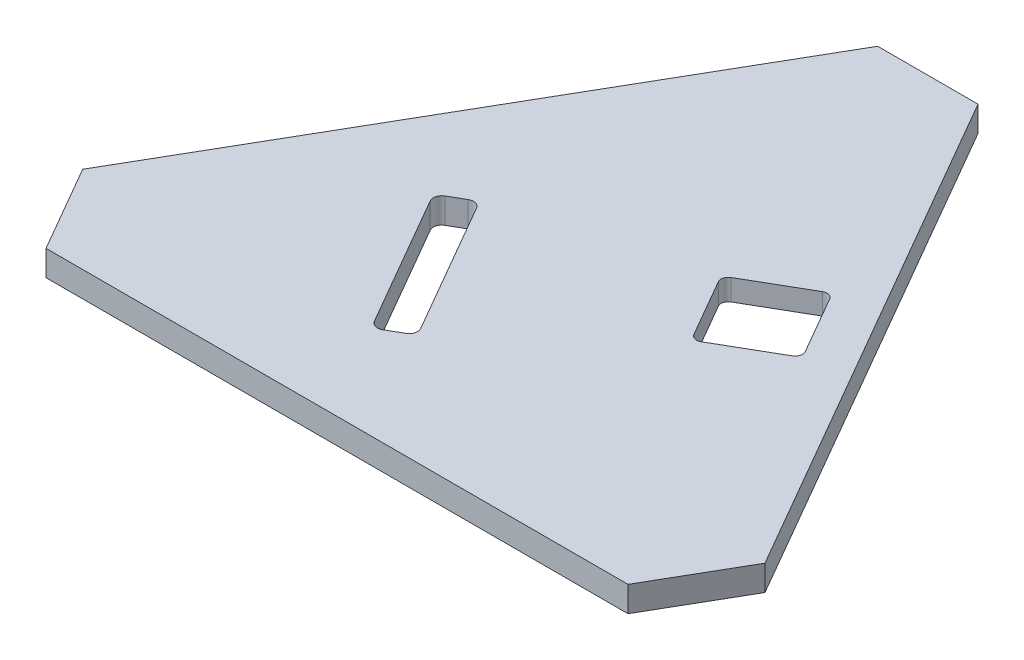
from build123d import *

# Parameters (mm, degrees)
BOSS_EXTRUDE1_DEPTH = 19.05
CUT_EXTRUDE1_DEPTH  = 20
CUT_EXTRUDE2_DEPTH  = 3.175
CUT_EXTRUDE3_DEPTH  = 19.05


with BuildPart() as part:
    # Sketch1 → Boss-Extrude1 (new body)
    with BuildSketch(Plane(origin=(-388.281715987, 0, -288.185661777), x_dir=(1, 0, 0), z_dir=(0, 1, 0))):
        Polygon((1747.570833697, -13084.824581071), (1672.514355591, -13084.824581071), (1454.703489965, -13462.084066777), (1492.231729019, -13527.084883536), (1927.853460271, -13527.084883536), (1965.381699324, -13462.084066777), align=None)
    extrude(amount=BOSS_EXTRUDE1_DEPTH)

    # Sketch4 → Cut-Extrude1 (cut)
    with BuildSketch(Plane(origin=(0, 19.05, 0), x_dir=(1, 0, 0), z_dir=(0, 1, 0))):
        with BuildLine():
            Line((1377.232664741, -13008.917958926), (1402.232664763, -13052.21922919))
            ThreePointArc((1402.232664763, -13052.21922919), (1405.572299736, -13054.781821235), (1409.745804474, -13054.232368895))
            Line((1409.745804474, -13054.232368895), (1453.047074654, -13029.232368878))
            ThreePointArc((1453.047074654, -13029.232368878), (1455.609666681, -13025.892733929), (1455.060214377, -13021.7192292))
            Line((1455.060214377, -13021.7192292), (1430.060214339, -12978.417958945))
            ThreePointArc((1430.060214339, -12978.417958945), (1426.720579378, -12975.855366909), (1422.547074644, -12976.404819231))
            Line((1422.547074644, -12976.404819231), (1379.245804465, -13001.404819247))
            ThreePointArc((1379.245804465, -13001.404819247), (1376.683212438, -13004.744454197), (1377.232664741, -13008.917958926))
        make_face()
    extrude(amount=-CUT_EXTRUDE1_DEPTH, mode=Mode.SUBTRACT)

    # Sketch5 → Cut-Extrude2 (cut)
    with BuildSketch(Plane.XZ):
        with BuildLine():
            Line((1427.670911631, 12961.899565184), (1364.121967469, 12998.589565203))
            ThreePointArc((1364.121967469, 12998.589565203), (1362.34679007, 13000.903021429), (1362.72741068, 13003.794121991))
            Line((1362.72741068, 13003.794121991), (1399.417410699, 13067.343066154))
            ThreePointArc((1399.417410699, 13067.343066154), (1401.730866926, 13069.118243552), (1404.621967488, 13068.737622942))
            Line((1404.621967488, 13068.737622942), (1468.17091165, 13032.047622923))
            ThreePointArc((1468.17091165, 13032.047622923), (1469.946089048, 13029.734166696), (1469.565468439, 13026.843066135))
            Line((1469.565468439, 13026.843066135), (1432.87546842, 12963.294121972))
            ThreePointArc((1432.87546842, 12963.294121972), (1430.562012193, 12961.518944574), (1427.670911631, 12961.899565184))
        make_face()
    extrude(amount=-CUT_EXTRUDE2_DEPTH, mode=Mode.SUBTRACT)

    # Sketch6 → Cut-Extrude3 (cut)
    with BuildSketch(Plane(origin=(0, 19.05, 0), x_dir=(1, 0, 0), z_dir=(0, 1, 0))):
        with BuildLine():
            Line((1216.964435014, -13064.325242236), (1274.114435014, -13163.311945889))
            ThreePointArc((1274.114435014, -13163.311945889), (1277.970195391, -13166.270574886), (1282.788696328, -13165.636207203))
            Line((1282.788696328, -13165.636207203), (1293.787218956, -13159.286207203))
            ThreePointArc((1293.787218956, -13159.286207203), (1296.745847953, -13155.430446825), (1296.11148027, -13150.611945889))
            Line((1296.11148027, -13150.611945889), (1238.96148027, -13051.625242236))
            ThreePointArc((1238.96148027, -13051.625242236), (1235.105719892, -13048.66661324), (1230.287218956, -13049.300980922))
            Line((1230.287218956, -13049.300980922), (1219.288696328, -13055.650980922))
            ThreePointArc((1219.288696328, -13055.650980922), (1216.330067331, -13059.5067413), (1216.964435014, -13064.325242236))
        make_face()
    extrude(amount=-CUT_EXTRUDE3_DEPTH, mode=Mode.SUBTRACT)


solid = part.part
